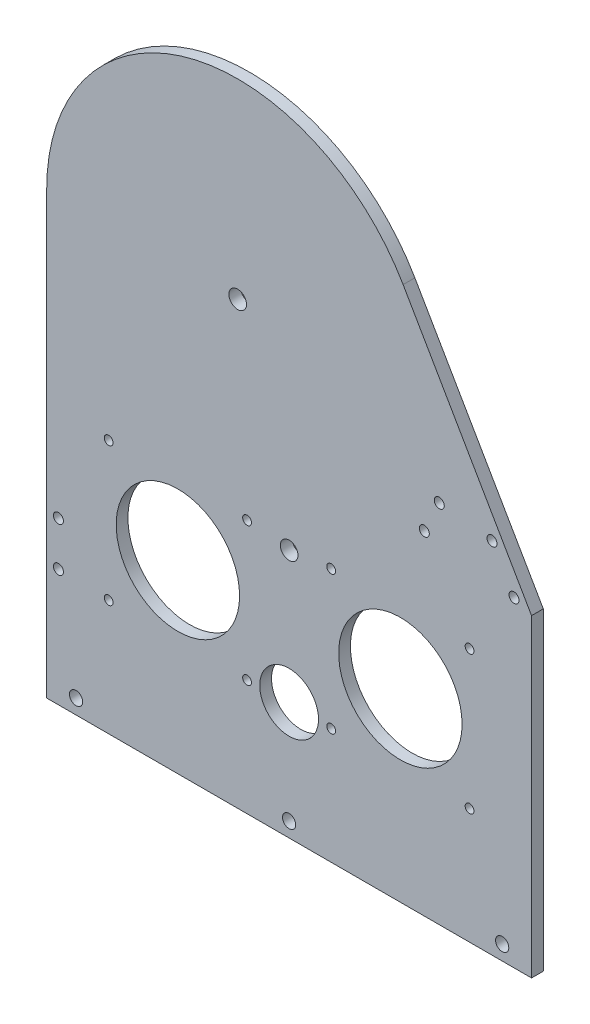
from build123d import *

# Parameters (mm, degrees)
ESQUISSE1_R                     = 3
ESQUISSE1_R_2                   = 10
ESQUISSE1_R_3                   = 2.25
ESQUISSE1_R_4                   = 1.7
ESQUISSE1_R_5                   = 21
BASE_EXTRUSION_DEPTH            = 4
ESQUISSE2_R                     = 1.5
ENL_V_MAT_EXTRU_1_DEPTH         = 272.046121537
R_P_TITION_LIN_AIRE1_COUNT      = 2
R_P_TITION_LIN_AIRE1_PITCH      = 47.1
R_P_TITION_LIN_AIRE1_COUNT_DIR2 = 2
R_P_TITION_LIN_AIRE1_PITCH_DIR2 = 47.1
ESQUISSE3_R                     = 1.5
ENL_V_MAT_EXTRU_2_DEPTH         = 234.557566427
R_P_TITION_LIN_AIRE2_COUNT      = 2
R_P_TITION_LIN_AIRE2_PITCH      = 47.1
R_P_TITION_LIN_AIRE2_COUNT_DIR2 = 2
R_P_TITION_LIN_AIRE2_PITCH_DIR2 = 47.1


with BuildPart() as part:
    # Esquisse1 → Base-Extrusion (new body)
    with BuildSketch(Plane.XY):
        with BuildLine():
            Line((0, 0), (165, 0))
            Line((165, 0), (165, 106.794919243))
            Line((165, 106.794919243), (121.291651246, 182.5))
            ThreePointArc((121.291651246, 182.5), (48.176762068, 212.785178709), (0, 150))
            Line((0, 150), (0, 0))
        make_face()
        with Locations((65, 150)):
            Circle(ESQUISSE1_R, mode=Mode.SUBTRACT)
        with Locations((82.5, 40)):
            Circle(ESQUISSE1_R_2, mode=Mode.SUBTRACT)
        with Locations((82.5, 5)):
            Circle(ESQUISSE1_R_3, mode=Mode.SUBTRACT)
        with Locations((10, 5)):
            Circle(ESQUISSE1_R_3, mode=Mode.SUBTRACT)
        with Locations((155, 5)):
            Circle(ESQUISSE1_R_3, mode=Mode.SUBTRACT)
        with Locations((4, 40)):
            Circle(ESQUISSE1_R_4, mode=Mode.SUBTRACT)
        with Locations((4, 55)):
            Circle(ESQUISSE1_R_4, mode=Mode.SUBTRACT)
        with Locations((82.5, 84.807975948)):
            Circle(ESQUISSE1_R, mode=Mode.SUBTRACT)
        with Locations((44.64, 62.957975948)):
            Circle(ESQUISSE1_R_5, mode=Mode.SUBTRACT)
        with Locations((120.36, 62.957975948)):
            Circle(ESQUISSE1_R_5, mode=Mode.SUBTRACT)
        with Locations((151.537549631, 122.112567277)):
            Circle(ESQUISSE1_R_4, mode=Mode.SUBTRACT)
        with Locations((159.037549631, 109.12218622)):
            Circle(ESQUISSE1_R_4, mode=Mode.SUBTRACT)
        with Locations((128.5, 113.5)):
            Circle(ESQUISSE1_R_4, mode=Mode.SUBTRACT)
        with Locations((133.6, 124.3)):
            Circle(ESQUISSE1_R_4, mode=Mode.SUBTRACT)
    extrude(amount=BASE_EXTRUSION_DEPTH)

    # Esquisse2 → Enlèv. mat.-Extru.1 (cut, through all)
    with BuildSketch(Plane.XY.offset(4)):
        with Locations((21.09, 86.507975948)):
            Circle(ESQUISSE2_R)
    enl_v_mat_extru_1 = extrude(amount=-ENL_V_MAT_EXTRU_1_DEPTH, mode=Mode.SUBTRACT)

    # Répétition linéaire1: Enl_v. mat.-Extru.1 2 × 2
    with Locations(*[(i * R_P_TITION_LIN_AIRE1_PITCH, -j * R_P_TITION_LIN_AIRE1_PITCH_DIR2, 0) for i in range(R_P_TITION_LIN_AIRE1_COUNT) for j in range(R_P_TITION_LIN_AIRE1_COUNT_DIR2) if (i, j) != (0, 0)]):
        add(enl_v_mat_extru_1, mode=Mode.SUBTRACT)

    # Esquisse3 → Enlèv. mat.-Extru.2 (cut, through all)
    with BuildSketch(Plane(origin=(31.548888889, 23.365092485, 4), x_dir=(1, 0, 0), z_dir=(0, 0, 1))):
        with Locations((65.261111111, 63.142883463)):
            Circle(ESQUISSE3_R)
    enl_v_mat_extru_2 = extrude(amount=-ENL_V_MAT_EXTRU_2_DEPTH, mode=Mode.SUBTRACT)

    # Répétition linéaire2: Enl_v. mat.-Extru.2 2 × 2
    with Locations(*[(i * R_P_TITION_LIN_AIRE2_PITCH, -j * R_P_TITION_LIN_AIRE2_PITCH_DIR2, 0) for i in range(R_P_TITION_LIN_AIRE2_COUNT) for j in range(R_P_TITION_LIN_AIRE2_COUNT_DIR2) if (i, j) != (0, 0)]):
        add(enl_v_mat_extru_2, mode=Mode.SUBTRACT)


solid = part.part
